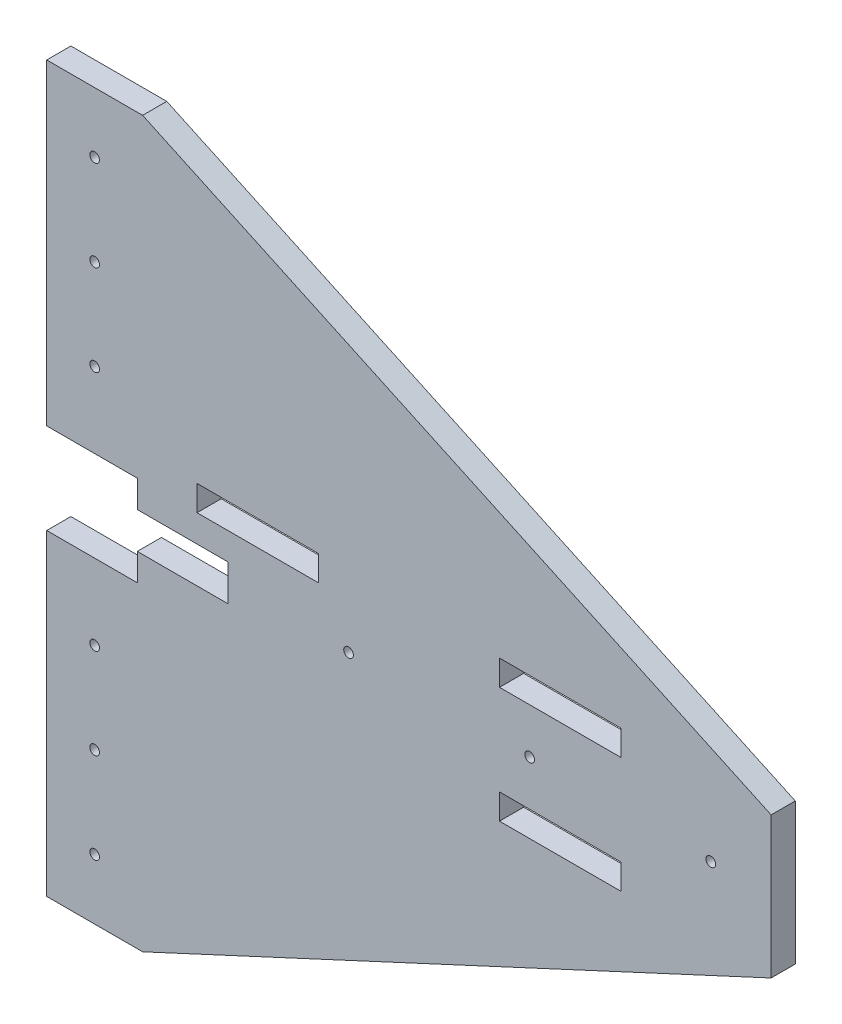
from build123d import *

# Parameters (mm, degrees)
SKETCH1_W               = 20.1
SKETCH1_H               = 4.2
BOSS_EXTRUDE1_DEPTH     = 4
SKETCH2_R               = 0.8
CUT_EXTRUDE1_DEPTH      = 4
LPATTERN2_COUNT         = 3
LPATTERN2_PITCH         = 15
MIRROR1_COPY_1_SKETCH_R = 0.8
MIRROR1_COPY_1_DEPTH    = 4
MIRROR1_COPY_2_SKETCH_R = 0.8
MIRROR1_COPY_2_DEPTH    = 4
MIRROR1_COPY_3_SKETCH_R = 0.8
MIRROR1_COPY_3_DEPTH    = 4
SKETCH2_4_R             = 0.8
CUT_EXTRUDE3_DEPTH      = 4
LPATTERN3_COUNT         = 5
LPATTERN3_PITCH         = 30
SKETCH3_W               = 15
SKETCH3_H               = 6
CUT_EXTRUDE4_DEPTH      = 4


with BuildPart() as part:
    # Sketch1 → Boss-Extrude1 (new body)
    with BuildSketch(Plane.XY):
        Polygon((0, 15), (0, 67.5), (15.887452938, 67.5), (120, 19.2), (120, -4.2), (15.887452938, -52.5), (0, -52.5), (0, 0), (15, 0), (15, 15), align=None)
        with Locations((85.05, -2.1)):
            Rectangle(SKETCH1_W, SKETCH1_H, mode=Mode.SUBTRACT)
        with Locations((85.05, 17.1)):
            Rectangle(SKETCH1_W, SKETCH1_H, mode=Mode.SUBTRACT)
        with Locations((34.95, 17.1)):
            Rectangle(SKETCH1_W, SKETCH1_H, mode=Mode.SUBTRACT)
    extrude(amount=BOSS_EXTRUDE1_DEPTH)

    # Sketch2 → Cut-Extrude1 (cut)
    with BuildSketch(Plane.XY.offset(4)):
        with Locations((7.943726469, 57.5)):
            Circle(SKETCH2_R)
    cut_extrude1 = extrude(amount=-CUT_EXTRUDE1_DEPTH, mode=Mode.SUBTRACT)

    # LPattern2: Cut-Extrude1 ×3
    with Locations(*[(0, -i * LPATTERN2_PITCH, 0) for i in range(1, LPATTERN2_COUNT)]):
        add(cut_extrude1, mode=Mode.SUBTRACT)

    # Mirror1 copy 1 sketch → Mirror1 copy 1 (cut)
    with BuildSketch(Plane(origin=(0, 30, 4), x_dir=(1, 0, 0), z_dir=(0, 0, 1))):
        with Locations((7.943726469, -57.5)):
            Circle(MIRROR1_COPY_1_SKETCH_R)
    extrude(amount=-MIRROR1_COPY_1_DEPTH, mode=Mode.SUBTRACT)

    # Mirror1 copy 2 sketch → Mirror1 copy 2 (cut)
    with BuildSketch(Plane(origin=(0, 45, 4), x_dir=(1, 0, 0), z_dir=(0, 0, 1))):
        with Locations((7.943726469, -57.5)):
            Circle(MIRROR1_COPY_2_SKETCH_R)
    extrude(amount=-MIRROR1_COPY_2_DEPTH, mode=Mode.SUBTRACT)

    # Mirror1 copy 3 sketch → Mirror1 copy 3 (cut)
    with BuildSketch(Plane(origin=(0, 15, 4), x_dir=(1, 0, 0), z_dir=(0, 0, 1))):
        with Locations((7.943726469, -57.5)):
            Circle(MIRROR1_COPY_3_SKETCH_R)
    extrude(amount=-MIRROR1_COPY_3_DEPTH, mode=Mode.SUBTRACT)

    # Sketch2<4> → Cut-Extrude3 (cut)
    with BuildSketch(Plane.XY.offset(4)):
        with Locations((110, 7.5)):
            Circle(SKETCH2_4_R)
    cut_extrude3 = extrude(amount=-CUT_EXTRUDE3_DEPTH, mode=Mode.SUBTRACT)

    # LPattern3: Cut-Extrude3 ×5
    with Locations(*[(-i * LPATTERN3_PITCH, 0, 0) for i in range(1, LPATTERN3_COUNT)]):
        add(cut_extrude3, mode=Mode.SUBTRACT)

    # Sketch3 → Cut-Extrude4 (cut)
    with BuildSketch(Plane.XY.offset(4)):
        with Locations((22.5, 7.5)):
            Rectangle(SKETCH3_W, SKETCH3_H)
    extrude(amount=-CUT_EXTRUDE4_DEPTH, mode=Mode.SUBTRACT)


solid = part.part
